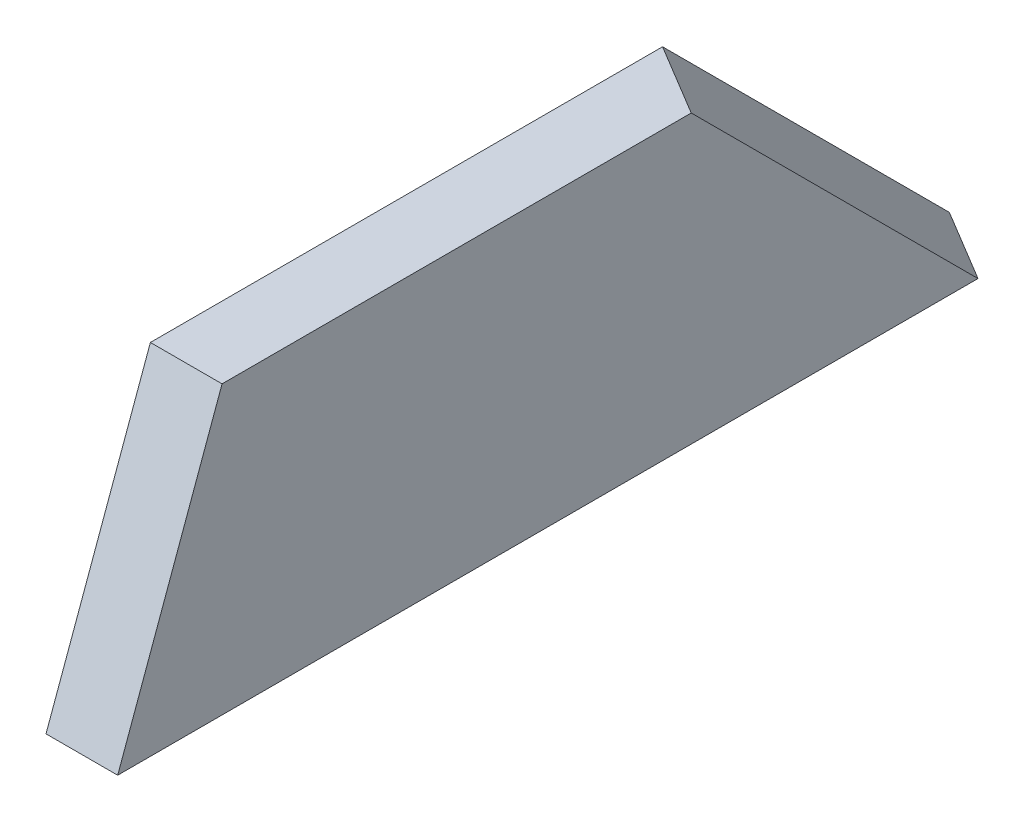
from build123d import *

# Parameters (mm, degrees)
BOSS_EXTRUDE1_DEPTH = 12.7
CUT_EXTRUDE3_DEPTH  = 101.600000001


with BuildPart() as part:
    # Sketch1 → Boss-Extrude1 (new body)
    with BuildSketch(Plane(origin=(0, 0, 0), x_dir=(0, 0, -1), z_dir=(1, 0, 0))):
        Polygon((-80.01, 0), (80.01, 0), (29.21, 50.8), (-61.520312099, 50.8), align=None)
    extrude(amount=BOSS_EXTRUDE1_DEPTH)

    # Sketch6 → Cut-Extrude3 (cut, along a direction that is not the sketch's normal)
    with BuildSketch(Plane.XZ):
        Polygon((0, -80.01), (12.7, -80.01), (12.7, -72.39), align=None)
    extrude(amount=-CUT_EXTRUDE3_DEPTH, dir=(0, -0.7071067811865437, -0.7071067811865513), mode=Mode.SUBTRACT)


solid = part.part
